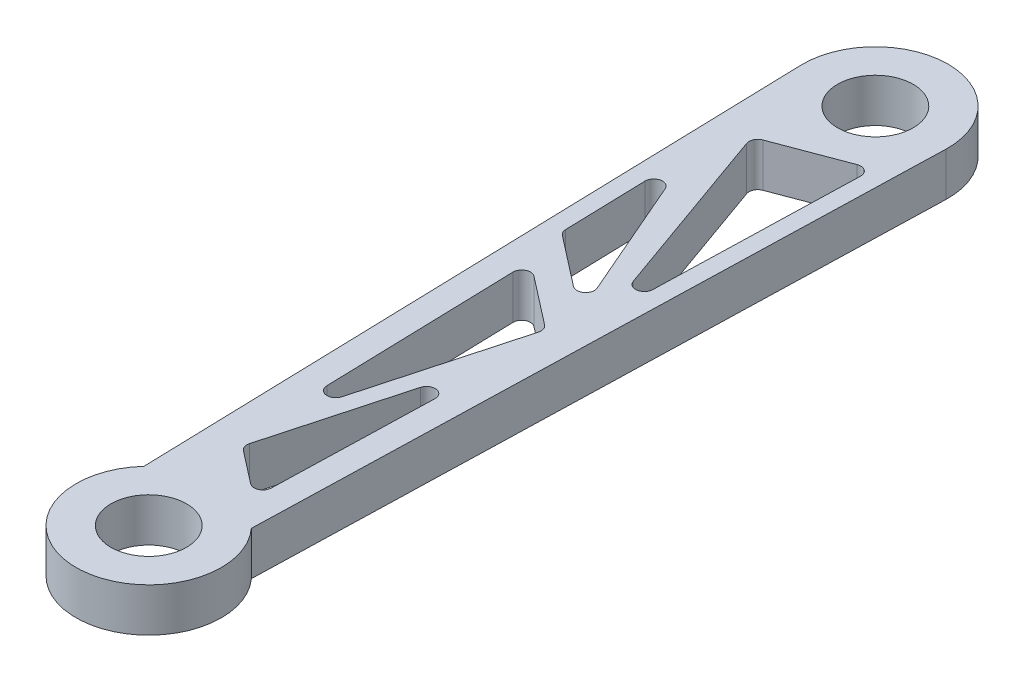
from build123d import *

# Parameters (mm, degrees)
SKETCH_1_R          = 5.05
SKETCH_1_R_2        = 13
EXTRUDE_1_DEPTH     = 15
FILLET_1_R          = 3
CUT_EXTRUDE_3_DEPTH = 277.54113618
FILLET_2_R          = 3
EXTRUDE_3_DEPTH     = 15
FILLET_4_R          = 3
SKETCH_8_R          = 13
CUT_EXTRUDE_5_DEPTH = 277.54113618
SKETCH_9_R          = 25
SKETCH_9_R_2        = 13
EXTRUDE_4_DEPTH     = 15


with BuildPart() as part:
    # 草图1 → 凸台-拉伸1 (new body)
    with BuildSketch(Plane(origin=(0, 0, 0), x_dir=(1, 0, 0), z_dir=(0, 1, 0))):
        with BuildLine():
            Line((-17.992942616, -0.504), (-24.990198078, 249.3))
            ThreePointArc((-24.990198078, 249.3), (0, 275), (24.990198078, 249.3))
            Line((24.990198078, 249.3), (17.992942616, -0.504))
            ThreePointArc((17.992942616, -0.504), (0, -18), (-17.992942616, -0.504))
        make_face()
        with Locations(Location((0, 0, 0), (0, 0, 270))):
            Circle(SKETCH_1_R, mode=Mode.SUBTRACT)
        with Locations(Location((0, 250, 0), (0, 0, 270))):
            Circle(SKETCH_1_R_2, mode=Mode.SUBTRACT)
        Polygon((-16.444447487, 158.5), (-17.704941698, 203.5), (11.028871219, 137.174942267), align=None, mode=Mode.SUBTRACT)
        Polygon((15.954255294, 141), (18.475243716, 231), (-12, 219.5), align=None, mode=Mode.SUBTRACT)
    extrude(amount=EXTRUDE_1_DEPTH)

    # 圆角1
    fillet_1_edges = [part.edges().sort_by_distance(p)[0] for p in [
        (-16.444447487, 7.5, -158.5),
        (11.028871219, 7.5, -137.174942267),
        (-17.704941698, 7.5, -203.5),
        (18.475243716, 7.5, -231),
        (-12, 7.5, -219.5),
        (15.954255294, 7.5, -141),
    ]]
    fillet(fillet_1_edges, radius=FILLET_1_R)

    # 草图4 → 切除-拉伸3 (cut, through all)
    with BuildSketch(Plane(origin=(0, 15, 0), x_dir=(1, 0, 0), z_dir=(0, 1, 0))):
        Polygon((-13.050343026, 144.472367448), (12.494927596, 124.643879429), (9.742058902, 26.365688077), (-10.175105816, 41.825585442), align=None)
    extrude(amount=-CUT_EXTRUDE_3_DEPTH, mode=Mode.SUBTRACT)

    # 圆角2
    fillet_2_edges = [part.edges().sort_by_distance(p)[0] for p in [
        (-10.175105816, 7.5, -41.825585442),
        (-13.050343026, 7.5, -144.472367448),
        (9.742058902, 7.5, -26.365688077),
    ]]
    fillet(fillet_2_edges, radius=FILLET_2_R)

    # 草图6 → 凸台-拉伸3 (add)
    with BuildSketch(Plane(origin=(0, 15, 0), x_dir=(1, 0, 0), z_dir=(0, 1, 0))):
        Polygon((9.60137553, 125.435937788), (-13.068657882, 42.617643801), (-7.609801347, 39.834371112), (-7.28155375, 41.033527083), (15.388479662, 123.85182107), (9.929623127, 126.635093759), align=None)
    extrude(amount=-EXTRUDE_3_DEPTH)

    # 圆角4
    fillet_4_edges = [part.edges().sort_by_distance(p)[0] for p in [
        (9.929623127, 7.5, -126.635093759),
        (12.14036175, 7.5, -111.985778385),
        (-7.609801347, 7.5, -39.834371112),
        (-10.463842583, 7.5, -52.133569747),
    ]]
    fillet(fillet_4_edges, radius=FILLET_4_R)

    # 草图8 → 切除-拉伸5 (cut, through all)
    with BuildSketch(Plane(origin=(0, 15, 0), x_dir=(1, 0, 0), z_dir=(0, 1, 0))):
        with Locations(Location((0, 0, 0), (0, 0, 270))):
            Circle(SKETCH_8_R)
    extrude(amount=-CUT_EXTRUDE_5_DEPTH, mode=Mode.SUBTRACT)

    # 草图9 → 凸台-拉伸4 (add)
    with BuildSketch(Plane(origin=(0, 15, 0), x_dir=(1, 0, 0), z_dir=(0, 1, 0))):
        Circle(SKETCH_9_R)
        with Locations(Location((0, 0, 0), (0, 0, 270))):
            Circle(SKETCH_9_R_2, mode=Mode.SUBTRACT)
    extrude(amount=-EXTRUDE_4_DEPTH)


solid = part.part
